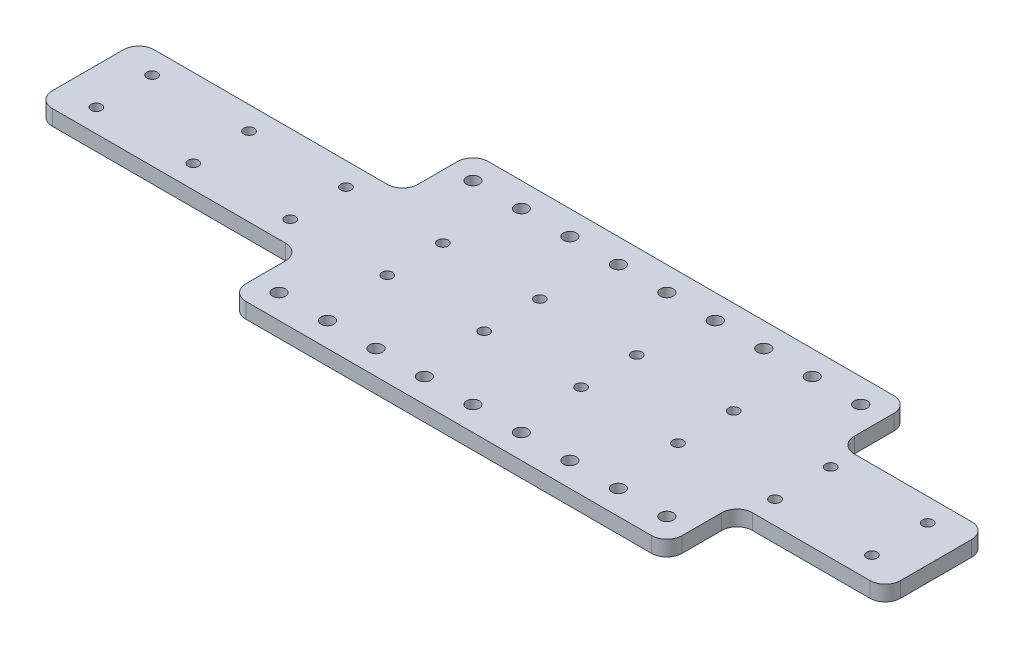
from build123d import *

# Parameters (mm, degrees)
SKETCH7_W           = 350
SKETCH7_H           = 42
BOSS_EXTRUDE3_DEPTH = 6.35
SKETCH2_R           = 2.15
CUT_EXTRUDE1_DEPTH  = 177.369845779
SKETCH1_W           = 180
SKETCH1_H           = 29.00074531
SKETCH1_H_2         = 28.99925469
BOSS_EXTRUDE4_DEPTH = 6.35
SKETCH3_R           = 2.65
CUT_EXTRUDE2_DEPTH  = 183.113692598
FILLET2_R           = 6.35


with BuildPart() as part:
    # Sketch7 → Boss-Extrude3 (new body)
    with BuildSketch(Plane(origin=(0, 0, 0), x_dir=(1, 0, 0), z_dir=(0, 1, 0))):
        Rectangle(SKETCH7_W, SKETCH7_H)
    extrude(amount=-BOSS_EXTRUDE3_DEPTH)

    # Sketch2 → Cut-Extrude1 (cut, through all)
    with BuildSketch(Plane(origin=(0, 0, 0), x_dir=(1, 0, 0), z_dir=(0, 1, 0))):
        with Locations(Location((120, 11.5, 0), (0, 0, 270))):
            Circle(SKETCH2_R)
        with Locations(Location((120, -11.5, 0), (0, 0, 90))):
            Circle(SKETCH2_R)
        with Locations(Location((80, 11.5, 0), (0, 0, 270))):
            Circle(SKETCH2_R)
        with Locations(Location((160, 11.5, 0), (0, 0, 270))):
            Circle(SKETCH2_R)
        with Locations(Location((80, -11.5, 0), (0, 0, 90))):
            Circle(SKETCH2_R)
        with Locations(Location((160, -11.5, 0), (0, 0, 90))):
            Circle(SKETCH2_R)
        with Locations(Location((40, 11.5, 0), (0, 0, 270))):
            Circle(SKETCH2_R)
        with Locations(Location((40, -11.5, 0), (0, 0, 90))):
            Circle(SKETCH2_R)
        with Locations(Location((0, 11.5, 0), (0, 0, 270))):
            Circle(SKETCH2_R)
        with Locations(Location((0, -11.5, 0), (0, 0, 90))):
            Circle(SKETCH2_R)
        with Locations(Location((-40, 11.5, 0), (0, 0, 270))):
            Circle(SKETCH2_R)
        with Locations(Location((-40, -11.5, 0), (0, 0, 90))):
            Circle(SKETCH2_R)
        with Locations(Location((-80, 11.5, 0), (0, 0, 270))):
            Circle(SKETCH2_R)
        with Locations(Location((-80, -11.5, 0), (0, 0, 90))):
            Circle(SKETCH2_R)
        with Locations(Location((-120, 11.5, 0), (0, 0, 270))):
            Circle(SKETCH2_R)
        with Locations(Location((-120, -11.5, 0), (0, 0, 90))):
            Circle(SKETCH2_R)
        with Locations(Location((-160, 11.5, 0), (0, 0, 270))):
            Circle(SKETCH2_R)
        with Locations(Location((-160, -11.5, 0), (0, 0, 90))):
            Circle(SKETCH2_R)
    extrude(amount=-CUT_EXTRUDE1_DEPTH, mode=Mode.SUBTRACT)

    # Sketch1 → Boss-Extrude4 (add, through all)
    with BuildSketch(Plane(origin=(0, 0, 0), x_dir=(1, 0, 0), z_dir=(0, 1, 0))):
        with Locations((23.874417882, -35.500372655)):
            Rectangle(SKETCH1_W, SKETCH1_H)
        with Locations((23.874417882, 35.499627345)):
            Rectangle(SKETCH1_W, SKETCH1_H_2)
    extrude(amount=-BOSS_EXTRUDE4_DEPTH)

    # Sketch3 → Cut-Extrude2 (cut, through all)
    with BuildSketch(Plane(origin=(0, 0, 0), x_dir=(1, 0, 0), z_dir=(0, 1, 0))):
        with Locations(Location((23.874417882, 39.99925469, 0), (0, 0, 270))):
            Circle(SKETCH3_R)
        with Locations(Location((43.874417882, 39.99925469, 0), (0, 0, 270))):
            Circle(SKETCH3_R)
        with Locations(Location((63.874417882, 39.99925469, 0), (0, 0, 270))):
            Circle(SKETCH3_R)
        with Locations(Location((103.874417882, 39.99925469, 0), (0, 0, 270))):
            Circle(SKETCH3_R)
        with Locations(Location((-36.125582118, 39.99925469, 0), (0, 0, 270))):
            Circle(SKETCH3_R)
        with Locations(Location((83.874417882, 39.99925469, 0), (0, 0, 270))):
            Circle(SKETCH3_R)
        with Locations(Location((-56.125582118, 39.99925469, 0), (0, 0, 270))):
            Circle(SKETCH3_R)
        with Locations(Location((-16.125582118, 39.99925469, 0), (0, 0, 270))):
            Circle(SKETCH3_R)
        with Locations(Location((3.874417882, 39.99925469, 0), (0, 0, 270))):
            Circle(SKETCH3_R)
        with Locations(Location((3.874417882, -40.00074531, 0), (0, 0, 270))):
            Circle(SKETCH3_R)
        with Locations(Location((-16.125582118, -40.00074531, 0), (0, 0, 270))):
            Circle(SKETCH3_R)
        with Locations(Location((-56.125582118, -40.00074531, 0), (0, 0, 270))):
            Circle(SKETCH3_R)
        with Locations(Location((83.874417882, -40.00074531, 0), (0, 0, 270))):
            Circle(SKETCH3_R)
        with Locations(Location((-36.125582118, -40.00074531, 0), (0, 0, 270))):
            Circle(SKETCH3_R)
        with Locations(Location((103.874417882, -40.00074531, 0), (0, 0, 270))):
            Circle(SKETCH3_R)
        with Locations(Location((63.874417882, -40.00074531, 0), (0, 0, 270))):
            Circle(SKETCH3_R)
        with Locations(Location((43.874417882, -40.00074531, 0), (0, 0, 270))):
            Circle(SKETCH3_R)
        with Locations(Location((23.874417882, -40.00074531, 0), (0, 0, 270))):
            Circle(SKETCH3_R)
    extrude(amount=-CUT_EXTRUDE2_DEPTH, mode=Mode.SUBTRACT)

    # Fillet2
    fillet2_edges = [part.edges().sort_by_distance(p)[0] for p in [
        (113.874417882, -3.175, 50.00074531),
        (113.874417882, -3.175, 21),
        (113.874417882, -3.175, -21),
        (113.874417882, -3.175, -49.99925469),
        (-66.125582118, -3.175, -49.99925469),
        (-66.125582118, -3.175, -21),
        (-175, -3.175, -21),
        (-175, -3.175, 21),
        (-66.125582118, -3.175, 50.00074531),
        (-66.125582118, -3.175, 21),
        (175, -3.175, 21),
        (175, -3.175, -21),
    ]]
    fillet(fillet2_edges, radius=FILLET2_R)


solid = part.part
